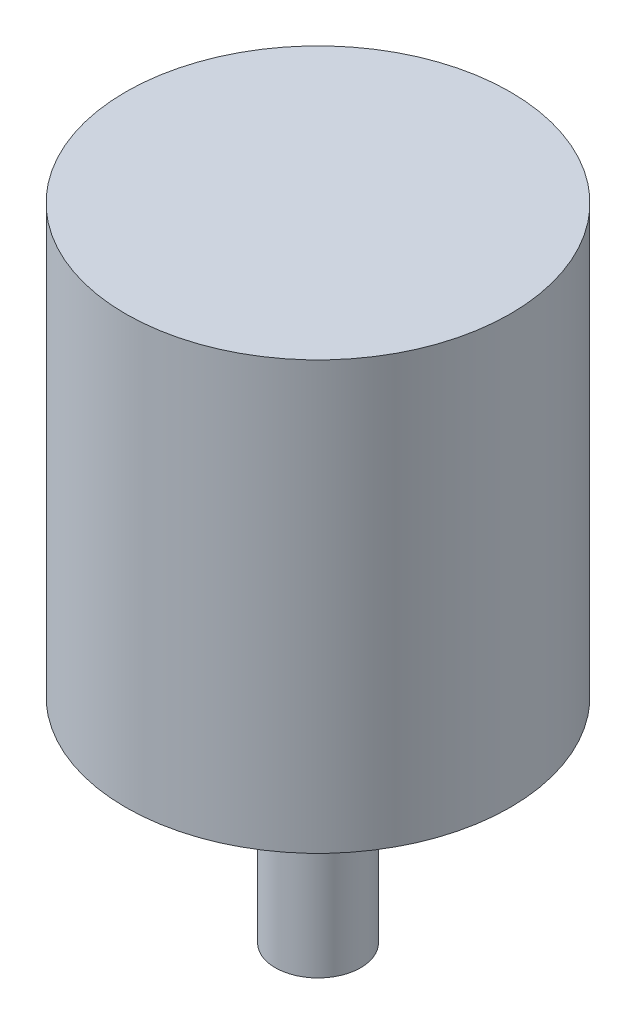
from build123d import *

# Parameters (mm, degrees)
SKETCH1_R           = 18
BOSS_EXTRUDE1_DEPTH = 40
SKETCH2_R           = 1.5
CUT_EXTRUDE1_DEPTH  = 5
CIRPATTERN1_COUNT   = 4
SKETCH3_R           = 11
BOSS_EXTRUDE2_DEPTH = 3
SKETCH4_R           = 4
BOSS_EXTRUDE3_DEPTH = 17
CUT_EXTRUDE2_START  = -15
CUT_EXTRUDE2_DEPTH  = 15


with BuildPart() as part:
    # Sketch1 → Boss-Extrude1 (new body)
    with BuildSketch(Plane(origin=(0, 0, 0), x_dir=(1, 0, 0), z_dir=(0, 1, 0))):
        with Locations(Location((0, 0, 0), (0, 0, 270))):
            Circle(SKETCH1_R)
    extrude(amount=BOSS_EXTRUDE1_DEPTH)

    # Sketch2 → Cut-Extrude1 (cut)
    with BuildSketch(Plane.XZ):
        with Locations(Location((-15, 0, 0), (0, 0, 270))):
            Circle(SKETCH2_R)
    cut_extrude1 = extrude(amount=-CUT_EXTRUDE1_DEPTH, mode=Mode.SUBTRACT)

    # CirPattern1: Cut-Extrude1 ×4 about axis
    cirpattern1_axis = Axis((0, 0, 0), (0, 1, 0))
    for i in range(1, CIRPATTERN1_COUNT):
        add(cut_extrude1.rotate(cirpattern1_axis, i * 360 / CIRPATTERN1_COUNT), mode=Mode.SUBTRACT)

    # Sketch3 → Boss-Extrude2 (add)
    with BuildSketch(Plane.XZ):
        with Locations(Location((0, 0, 0), (0, 0, 90))):
            Circle(SKETCH3_R)
    extrude(amount=BOSS_EXTRUDE2_DEPTH)

    # Sketch4 → Boss-Extrude3 (add)
    with BuildSketch(Plane.XZ.offset(3)):
        with Locations(Location((0, 0, 0), (0, 0, 270))):
            Circle(SKETCH4_R)
    extrude(amount=BOSS_EXTRUDE3_DEPTH)

    # Sketch5 → Cut-Extrude2 (cut)
    with BuildSketch(Plane.XZ.offset(20).offset(CUT_EXTRUDE2_START)):
        with BuildLine():
            Line((-2.645751311, -3), (2.645751311, -3))
            ThreePointArc((2.645751311, -3), (0, -4), (-2.645751311, -3))
        make_face()
    extrude(amount=CUT_EXTRUDE2_DEPTH, mode=Mode.SUBTRACT)


solid = part.part
